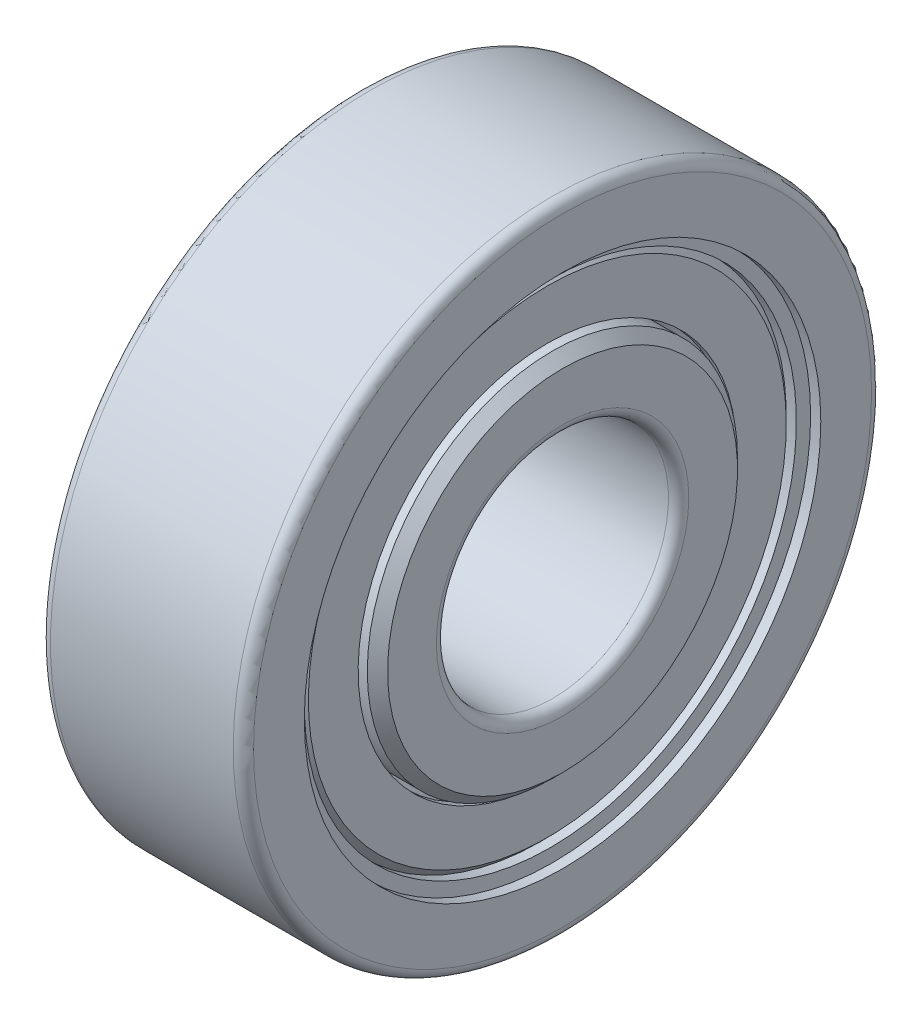
from build123d import *

# Parameters (mm, degrees)
FILLET_1_R     = 0.35
CHAMFER_1_SIZE = 0.35


with BuildPart() as part:
    # 草图1 → 旋转1 (revolve)
    with BuildSketch(Plane.XY):
        with BuildLine():
            Line((-3.5, 4), (-3.5, 6.38))
            Line((-3.5, 6.38), (-0.99979998, 6.38))
            ThreePointArc((-0.99979998, 6.38), (-1.39596418, 7.466226213), (-0.84, 8.48))
            Line((-0.84, 8.48), (-2.45, 8.48))
            Line((-2.45, 8.48), (-2.73, 8.2))
            Line((-2.73, 8.2), (-2.73, 6.52))
            Line((-2.73, 6.52), (-2.975, 6.52))
            Line((-2.975, 6.52), (-2.975, 8.235))
            Line((-2.975, 8.235), (-2.73, 8.48))
            Line((-2.73, 8.48), (-3.08, 8.48))
            Line((-3.08, 8.48), (-3.08, 9.021243557))
            Line((-3.08, 9.021243557), (-3.15, 8.9))
            Line((-3.15, 8.9), (-3.5, 8.9))
            Line((-3.5, 8.9), (-3.5, 11))
            Line((-3.5, 11), (3.5, 11))
            Line((3.5, 11), (3.5, 8.9))
            Line((3.5, 8.9), (3.15, 8.9))
            Line((3.15, 8.9), (3.08, 9.021243557))
            Line((3.08, 9.021243557), (3.08, 8.48))
            Line((3.08, 8.48), (2.73, 8.48))
            Line((2.73, 8.48), (2.975, 8.235))
            Line((2.975, 8.235), (2.975, 6.52))
            Line((2.975, 6.52), (2.73, 6.52))
            Line((2.73, 6.52), (2.73, 8.2))
            Line((2.73, 8.2), (2.45, 8.48))
            Line((2.45, 8.48), (0.84, 8.48))
            ThreePointArc((0.84, 8.48), (1.39596418, 7.466226213), (0.99979998, 6.38))
            Line((0.99979998, 6.38), (3.5, 6.38))
            Line((3.5, 6.38), (3.5, 4))
            Line((3.5, 4), (-3.5, 4))
        make_face()
    revolve(axis=Axis((0, 0, 0), (-1, 0, 0)))

    # 圆角1
    fillet_1_edges = [part.edges().sort_by_distance(p)[0] for p in [
        (3.5, -4, 0),
        (-3.5, -4, 0),
        (-3.5, -11, 0),
        (3.5, -11, 0),
    ]]
    fillet(fillet_1_edges, radius=FILLET_1_R)

    # 倒角1
    chamfer_1_edges = [part.edges().sort_by_distance(p)[0] for p in [
        (-3.5, -6.38, 0),
        (3.5, -6.38, 0),
    ]]
    chamfer(chamfer_1_edges, length=CHAMFER_1_SIZE)


solid = part.part
